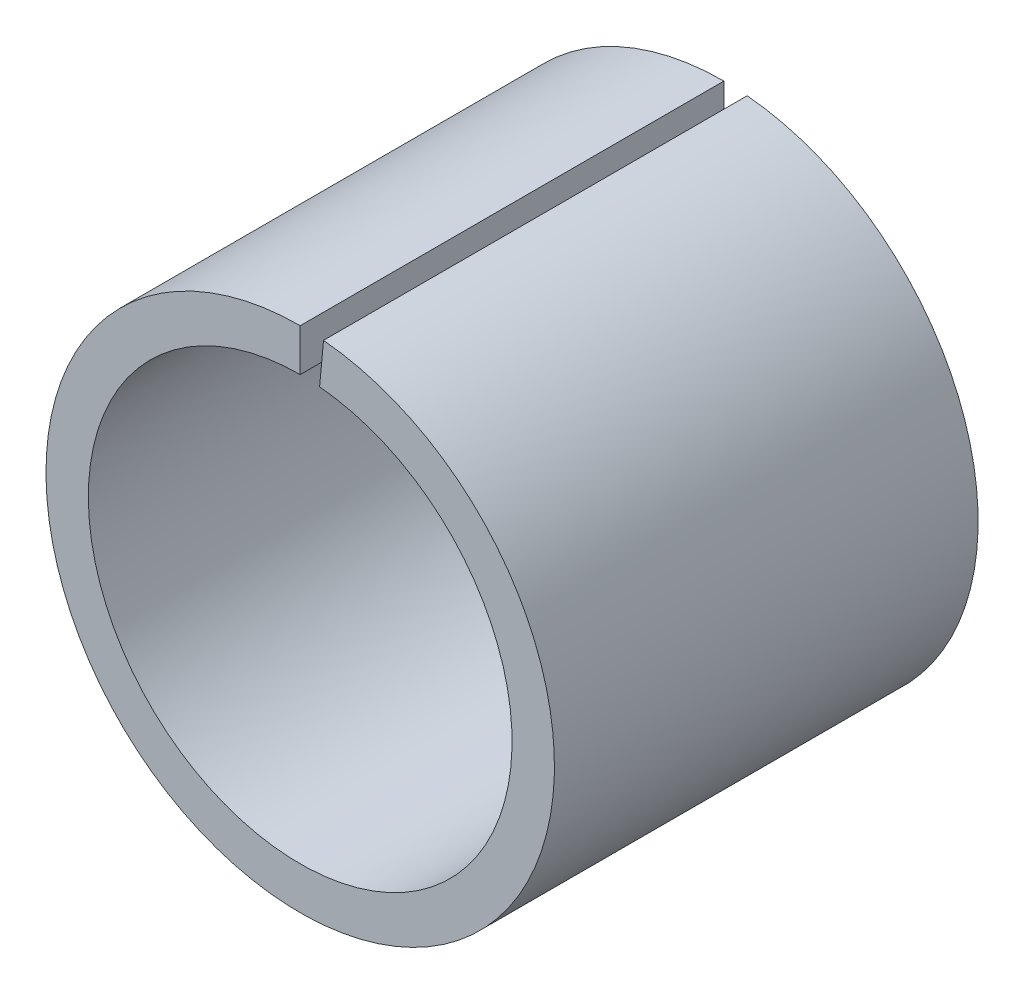
from build123d import *

# Parameters (mm, degrees)
SKETCH_1_R          = 6
SKETCH_1_R_2        = 5
EXTRUDE_1_DEPTH     = 10
CUT_EXTRUDE_1_DEPTH = 20


with BuildPart() as part:
    # 草图1 → 凸台-拉伸1 (new body)
    with BuildSketch(Plane.XY):
        Circle(SKETCH_1_R)
        Circle(SKETCH_1_R_2, mode=Mode.SUBTRACT)
    extrude(amount=EXTRUDE_1_DEPTH)

    # 草图2 → 切除-拉伸1 (cut)
    with BuildSketch(Plane.XY.offset(10)):
        Polygon((0, 0), (0, 6), (0.587596227, 6.386088304), align=None)
    extrude(amount=-CUT_EXTRUDE_1_DEPTH, mode=Mode.SUBTRACT)


solid = part.part
